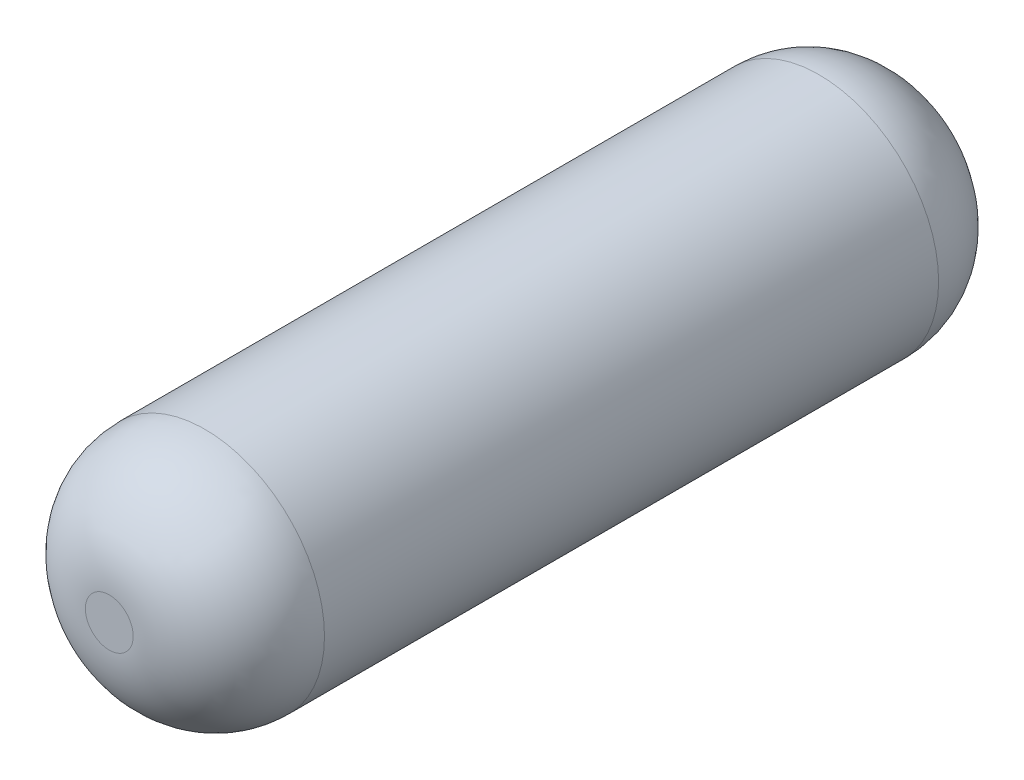
from build123d import *

# Parameters (mm, degrees)
SKETCH1_R      = 60.325
EXTRUDE1_DEPTH = 406.4
FILLET1_R      = 48.26


with BuildPart() as part:
    # Sketch1 → Extrude1 (new body)
    with BuildSketch(Plane.XY):
        Circle(SKETCH1_R)
    extrude(amount=EXTRUDE1_DEPTH)

    # Fillet1
    fillet1_edges = [part.edges().sort_by_distance(p)[0] for p in [
        (-60.325, 0, 0),
        (-60.325, 0, 406.4),
    ]]
    fillet(fillet1_edges, radius=FILLET1_R)


solid = part.part
